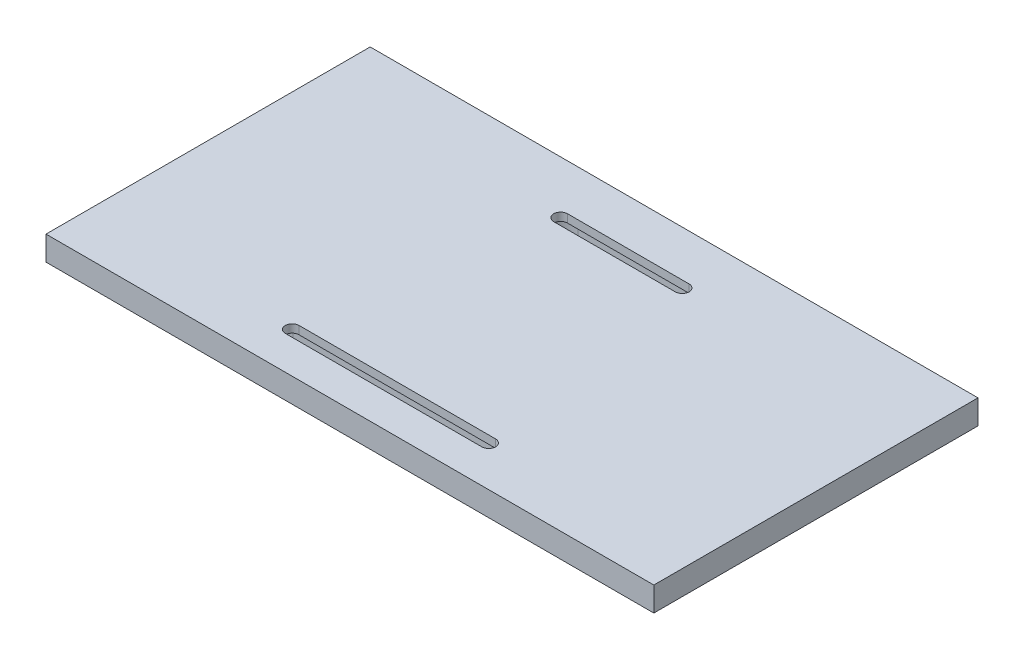
from build123d import *

# Parameters (mm, degrees)
ESQUISSE2_W                                        = 150
ESQUISSE2_H                                        = 80
BOSS_EXTRU_1_DEPTH                                 = 6
CHAMBRAGE_POUR_VIS_T_TE_HEXAGONALE_M31_D           = 3.4
CHAMBRAGE_POUR_VIS_T_TE_HEXAGONALE_M31_DEPTH       = 15
CHAMBRAGE_POUR_VIS_T_TE_HEXAGONALE_M31_CBORE_D     = 6.5
CHAMBRAGE_POUR_VIS_T_TE_HEXAGONALE_M31_CBORE_DEPTH = 3.4
CHAMBRAGE_POUR_VIS_T_TE_HEXAGONALE_M31_TIP         = 1.021463052
ENL_V_MAT_EXTRU_2_DEPTH                            = 4
ENL_V_MAT_EXTRU_3_DEPTH                            = 171.1058494
ENL_V_MAT_EXTRU_4_DEPTH                            = 4
ENL_V_START                                        = -4
ENL_V_MAT_EXTRU_5_DEPTH                            = 4


with BuildPart() as part:
    # Esquisse2 → Boss.-Extru.1 (new body)
    with BuildSketch(Plane(origin=(0, 0, 0), x_dir=(1, 0, 0), z_dir=(0, 1, 0))):
        with Locations((75, 40)):
            Rectangle(ESQUISSE2_W, ESQUISSE2_H)
    extrude(amount=BOSS_EXTRU_1_DEPTH)

    # Chambrage pour vis à tête hexagonale M31
    with Locations(Plane(origin=(90, 0, -67), x_dir=(0, 0, -1), z_dir=(0, -1, 0))):
        with Locations((0, 0), (0, -30), (-57, -39.25), (-57, 9.25)):
            CounterBoreHole(CHAMBRAGE_POUR_VIS_T_TE_HEXAGONALE_M31_D / 2, CHAMBRAGE_POUR_VIS_T_TE_HEXAGONALE_M31_CBORE_D / 2, CHAMBRAGE_POUR_VIS_T_TE_HEXAGONALE_M31_CBORE_DEPTH, depth=CHAMBRAGE_POUR_VIS_T_TE_HEXAGONALE_M31_DEPTH)
            with Locations((0, 0, -(CHAMBRAGE_POUR_VIS_T_TE_HEXAGONALE_M31_DEPTH + CHAMBRAGE_POUR_VIS_T_TE_HEXAGONALE_M31_TIP / 2))):  # 118° drill point
                Cone(0, CHAMBRAGE_POUR_VIS_T_TE_HEXAGONALE_M31_D / 2, CHAMBRAGE_POUR_VIS_T_TE_HEXAGONALE_M31_TIP, mode=Mode.SUBTRACT)

    # Esquisse6 → Enlèv. mat.-Extru.2 (cut)
    with BuildSketch(Plane.XZ):
        with BuildLine():
            Line((90, -71.278666631), (60, -71.278666631))
            ThreePointArc((60, -71.278666631), (55.721333369, -67), (60, -62.721333369))
            Line((60, -62.721333369), (90, -62.721333369))
            ThreePointArc((90, -62.721333369), (94.278666631, -67), (90, -71.278666631))
        make_face()
    extrude(amount=-ENL_V_MAT_EXTRU_2_DEPTH, mode=Mode.SUBTRACT)

    # Esquisse7 → Enlèv. mat.-Extru.3 (cut, through all)
    with BuildSketch(Plane.XZ):
        with BuildLine():
            Line((90, -68.7), (60, -68.7))
            ThreePointArc((60, -68.7), (58.3, -67), (60, -65.3))
            Line((60, -65.3), (90, -65.3))
            ThreePointArc((90, -65.3), (91.7, -67), (90, -68.7))
        make_face()
    extrude(amount=-ENL_V_MAT_EXTRU_3_DEPTH, mode=Mode.SUBTRACT)

    # Esquisse9 → Enlèv. mat.-Extru.4 (cut)
    with BuildSketch(Plane(origin=(0, 0, 0), x_dir=(-1, 0, 0), z_dir=(0, -1, 0))):
        with BuildLine():
            Line((-102.5, 13.5), (-47.5, 13.5))
            ThreePointArc((-47.5, 13.5), (-44, 10), (-47.5, 6.5))
            Line((-47.5, 6.5), (-102.5, 6.5))
            ThreePointArc((-102.5, 6.5), (-106, 10), (-102.5, 13.5))
        make_face()
    extrude(amount=-ENL_V_MAT_EXTRU_4_DEPTH, mode=Mode.SUBTRACT)

    # Esquisse10 → Enlèv. mat.-Extru.5 (cut)
    with BuildSketch(Plane(origin=(0, 4, 0), x_dir=(-1, 0, 0), z_dir=(0, -1, 0)).offset(ENL_V_START)):
        with BuildLine():
            Line((-99.25, 11.7), (-50.75, 11.7))
            ThreePointArc((-50.75, 11.7), (-49.05, 10), (-50.75, 8.3))
            Line((-50.75, 8.3), (-99.25, 8.3))
            ThreePointArc((-99.25, 8.3), (-100.95, 10), (-99.25, 11.7))
        make_face()
    extrude(amount=ENL_V_MAT_EXTRU_5_DEPTH, mode=Mode.SUBTRACT)


solid = part.part
